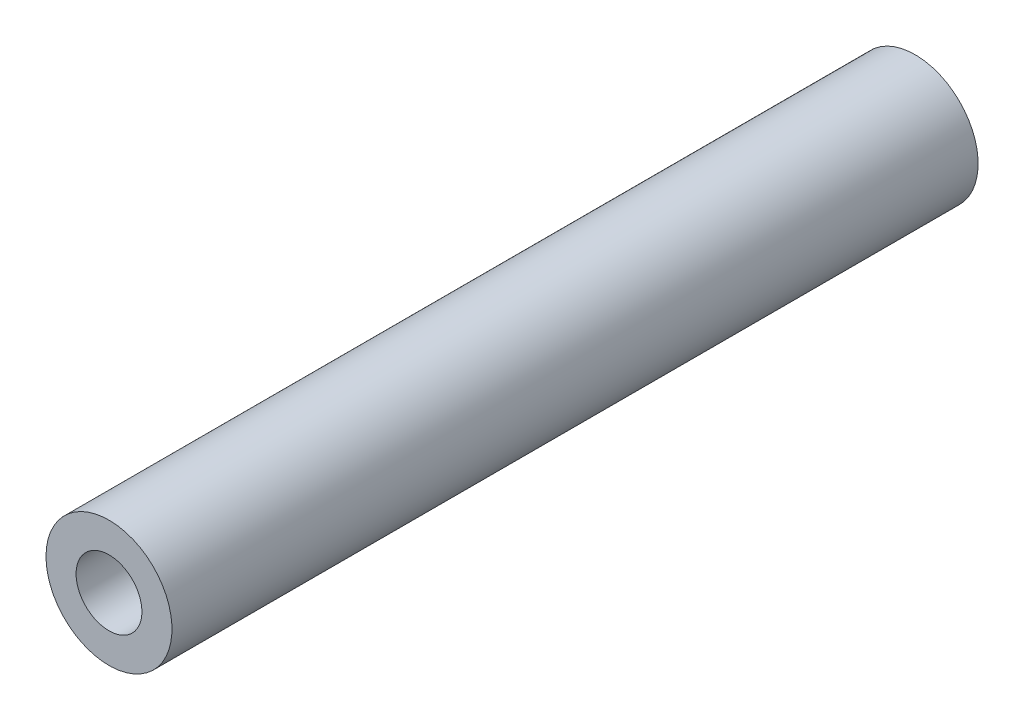
from build123d import *

# Parameters (mm, degrees)
SKETCH1_R           = 4.7625
SKETCH1_R_2         = 2.4892
BOSS_EXTRUDE1_DEPTH = 30.48


with BuildPart() as part:
    # Sketch1 → Boss-Extrude1 (new, symmetric)
    with BuildSketch(Plane.XY):
        with Locations(Location((0, 0, 0), (0, 0, 180))):
            Circle(SKETCH1_R)
        with Locations(Location((0, 0, 0), (0, 0, 180))):
            Circle(SKETCH1_R_2, mode=Mode.SUBTRACT)
    extrude(amount=BOSS_EXTRUDE1_DEPTH, both=True)


solid = part.part
